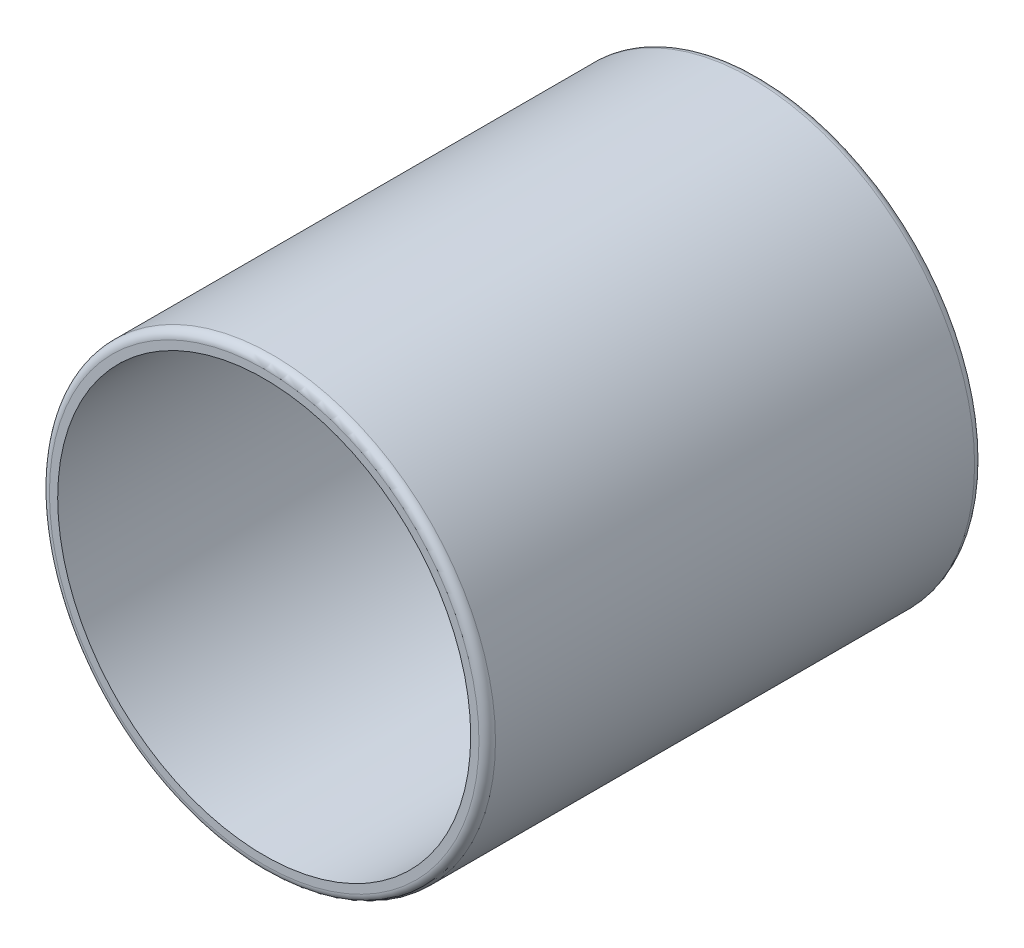
from build123d import *

# Parameters (mm, degrees)
SKETCH1_R           = 270
SKETCH1_R_2         = 250
EXTRUDE_THIN1_DEPTH = 600
FILLET1_R           = 10


with BuildPart() as part:
    # Sketch1 → Extrude-Thin1 (new body)
    with BuildSketch(Plane.XY):
        Circle(SKETCH1_R)
        Circle(SKETCH1_R_2, mode=Mode.SUBTRACT)
    extrude(amount=EXTRUDE_THIN1_DEPTH)

    # Fillet1
    fillet1_edges = [part.edges().sort_by_distance(p)[0] for p in [
        (-270, 0, 0),
        (-270, 0, 600),
    ]]
    fillet(fillet1_edges, radius=FILLET1_R)


solid = part.part
